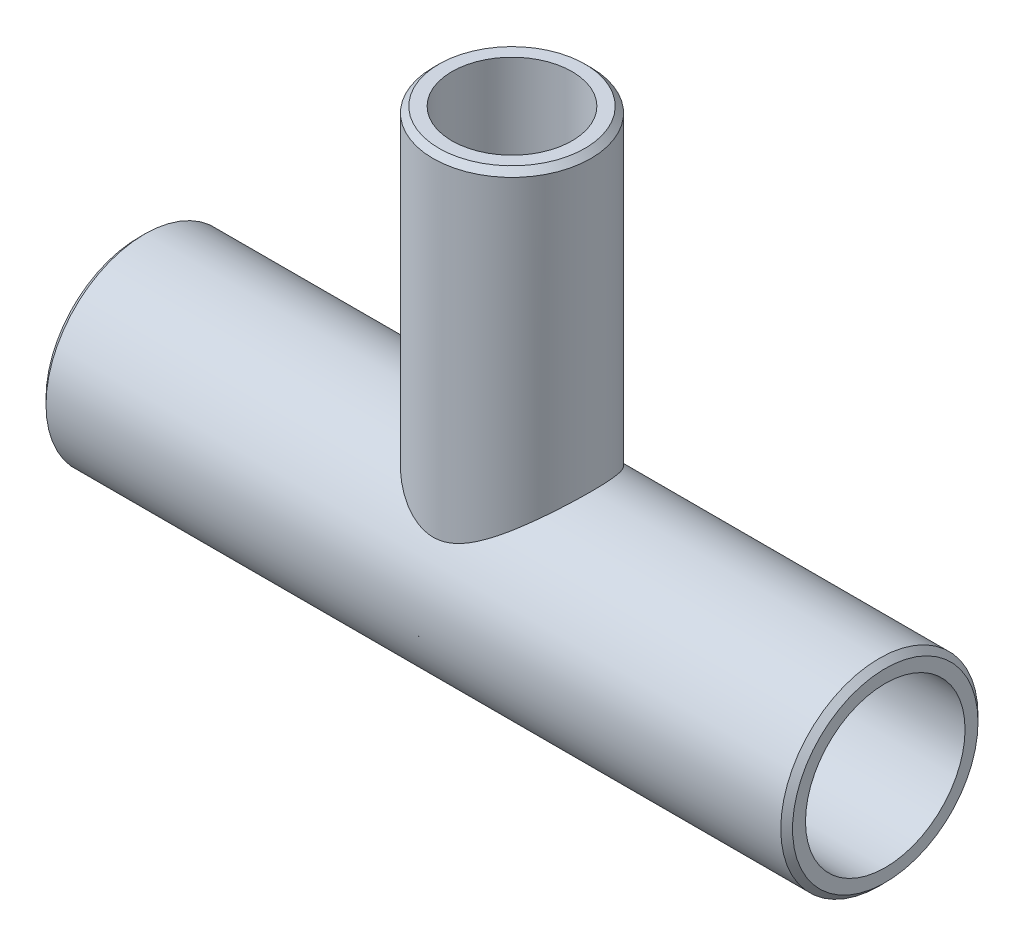
from build123d import *

# Parameters (mm, degrees)
RUNROUTE_R          = 16.75
RUNEXTRUDE_DEPTH    = 63.4
OUTLETROUTE_R       = 13.4
OUTLETEXTRUDE_DEPTH = 66.75
TEESHELL_T          = -3.2
TEECHAMFER_SIZE     = 1


with BuildPart() as part:
    # RunRoute → RunExtrude (new body)
    with BuildSketch(Plane(origin=(0, 0, 0), x_dir=(0, 0, -1), z_dir=(1, 0, 0))):
        Circle(RUNROUTE_R)
    runextrude = extrude(amount=RUNEXTRUDE_DEPTH)

    # RunExtrudeMirror: RunExtrude across plane
    add(runextrude.mirror(Plane(origin=(0, 0, 0), x_dir=(0, 0, 1), z_dir=(1, 0, 0))))

    # OutletRoute → OutletExtrude (add)
    with BuildSketch(Plane(origin=(0, 0, 0), x_dir=(1, 0, 0), z_dir=(0, 1, 0))):
        Circle(OUTLETROUTE_R)
    extrude(amount=OUTLETEXTRUDE_DEPTH)

    # TeeShell
    teeshell_openings = [part.faces().sort_by_distance(p)[0] for p in [
        (-63.4, 0, 0),
        (63.4, 0, 0),
        (0, 66.75, 0),
    ]]
    offset(amount=TEESHELL_T, openings=teeshell_openings, kind=Kind.INTERSECTION)

    # TeeChamfer
    teechamfer_edges = [part.edges().sort_by_distance(p)[0] for p in [
        (-13.4, 66.75, 0),
        (63.4, 0, 16.75),
        (-63.4, 0, 16.75),
    ]]
    chamfer(teechamfer_edges, length=TEECHAMFER_SIZE)


solid = part.part
